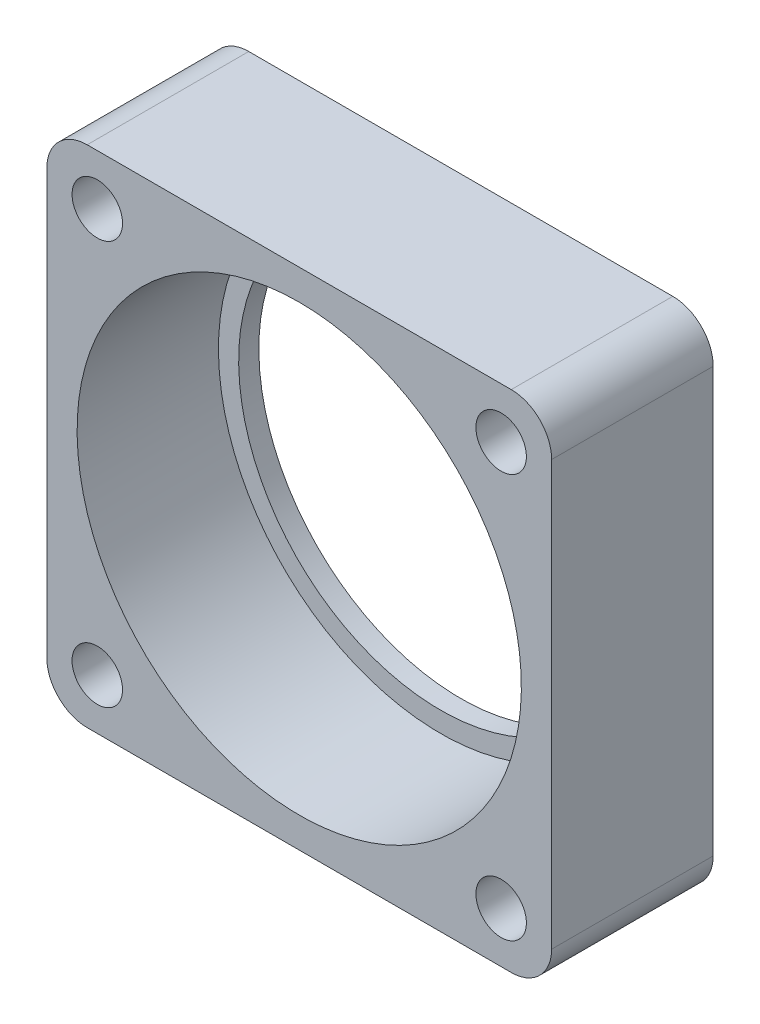
from build123d import *

# Parameters (mm, degrees)
ESQUISSE1_W        = 25
ESQUISSE1_H        = 25
ESQUISSE1_R        = 1.25
BOSS_EXTRU_1_DEPTH = 8
CONG_1_R           = 2


with BuildPart() as part:
    # Esquisse1 → Boss.-Extru.1 (new body)
    with BuildSketch(Plane.XY):
        Rectangle(ESQUISSE1_W, ESQUISSE1_H)
        with Locations((-10, 10)):
            Circle(ESQUISSE1_R, mode=Mode.SUBTRACT)
        with Locations(Location((10, 10, 0), (0, 0, 180))):
            Circle(ESQUISSE1_R, mode=Mode.SUBTRACT)
        with Locations((10, -10)):
            Circle(ESQUISSE1_R, mode=Mode.SUBTRACT)
        with Locations(Location((-10, -10, 0), (0, 0, 180))):
            Circle(ESQUISSE1_R, mode=Mode.SUBTRACT)
    extrude(amount=BOSS_EXTRU_1_DEPTH)

    # Esquisse2 → Enlèvement de matière-Révolution1 (revolve, cut)
    with BuildSketch(Plane(origin=(0, 0, 0), x_dir=(0, 0, -1), z_dir=(1, 0, 0))):
        Polygon((-8, 0), (0, 0), (0, 10), (-1, 10), (-1, 11), (-8, 11), align=None)
    revolve(axis=Axis((0, 0, 8), (0, 0, 1)), mode=Mode.SUBTRACT)

    # Congé1
    cong_1_edges = [part.edges().sort_by_distance(p)[0] for p in [
        (-12.5, 12.5, 4),
        (12.5, 12.5, 4),
        (12.5, -12.5, 4),
        (-12.5, -12.5, 4),
    ]]
    fillet(cong_1_edges, radius=CONG_1_R)


solid = part.part
